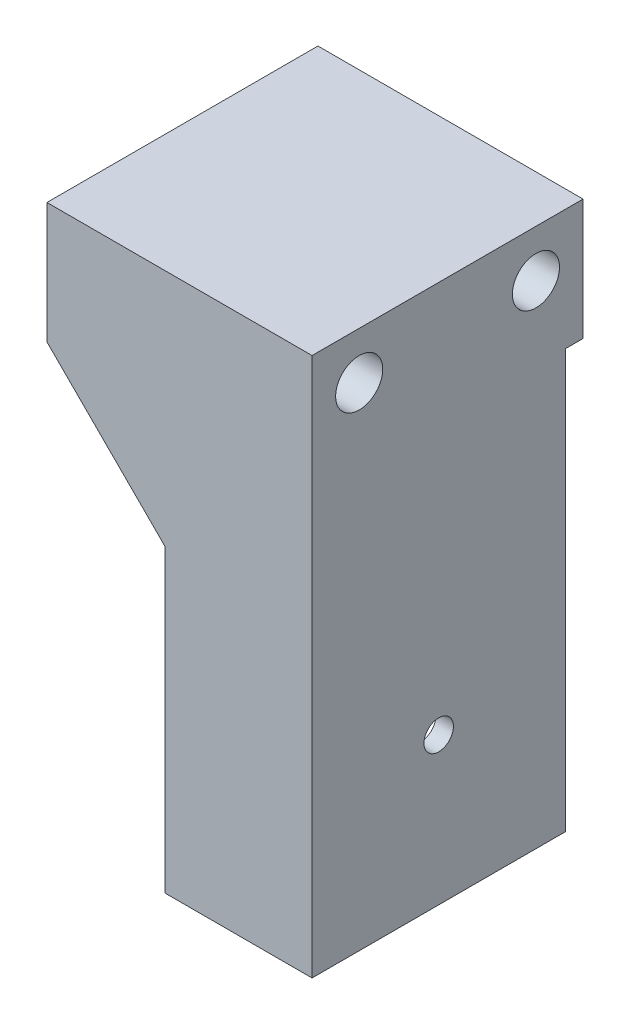
from build123d import *

# Parameters (mm, degrees)
BOSS_EXTRUDE1_DEPTH = 75
SKETCH2_W           = 42
SKETCH2_H           = 40
SKETCH2_R           = 2.5
BOSS_EXTRUDE2_DEPTH = 4
BOSS_EXTRUDE3_DEPTH = 3
SKETCH4_R           = 2.5
CUT_EXTRUDE1_DEPTH  = 3
SKETCH5_W           = 43
SKETCH5_H           = 16.5
SKETCH5_R           = 4
BOSS_EXTRUDE4_DEPTH = 45
SKETCH6_W           = 45
SKETCH6_H           = 20.5
BOSS_EXTRUDE6_DEPTH = 3


with BuildPart() as part:
    # Sketch1 → Boss-Extrude1 (new body)
    with BuildSketch(Plane(origin=(0, 0, 0), x_dir=(1, 0, 0), z_dir=(0, 1, 0))):
        Polygon((0, 0), (0, 40), (3, 40), (3, -3), (-22, -3), (-22, 0), align=None)
    extrude(amount=BOSS_EXTRUDE1_DEPTH)

    # Sketch2 → Boss-Extrude2 (add)
    with BuildSketch(Plane(origin=(0, 75, 0), x_dir=(1, 0, 0), z_dir=(0, 1, 0))):
        with Locations((-21, 20)):
            Rectangle(SKETCH2_W, SKETCH2_H)
        with Locations(Location((-17, 20, 0), (0, 0, 270))):
            Circle(SKETCH2_R, mode=Mode.SUBTRACT)
    extrude(amount=-BOSS_EXTRUDE2_DEPTH)

    # Sketch3 → Boss-Extrude3 (add)
    with BuildSketch(Plane.XY):
        Polygon((-22, 75), (-42, 75), (-42, 71), (-22, 51), align=None)
    extrude(amount=BOSS_EXTRUDE3_DEPTH)

    # Sketch4 → Cut-Extrude1 (cut)
    with BuildSketch(Plane(origin=(3, 0, 0), x_dir=(0, 0, -1), z_dir=(1, 0, 0))):
        with Locations((18.5, 25)):
            Circle(SKETCH4_R)
    extrude(amount=-CUT_EXTRUDE1_DEPTH, mode=Mode.SUBTRACT)

    # Sketch5 → Boss-Extrude4 (add)
    with BuildSketch(Plane.ZY.offset(42)):
        with Locations((-18.5, 83.25)):
            Rectangle(SKETCH5_W, SKETCH5_H)
        with Locations((-35, 83.5)):
            Circle(SKETCH5_R, mode=Mode.SUBTRACT)
        with Locations((-5, 83.5)):
            Circle(SKETCH5_R, mode=Mode.SUBTRACT)
    extrude(amount=-BOSS_EXTRUDE4_DEPTH)

    # Sketch6 → Boss-Extrude6 (add)
    with BuildSketch(Plane(origin=(0, 0, -40), x_dir=(-1, 0, 0), z_dir=(0, 0, -1))):
        with Locations((19.5, 81.25)):
            Rectangle(SKETCH6_W, SKETCH6_H)
    extrude(amount=BOSS_EXTRUDE6_DEPTH)


solid = part.part
